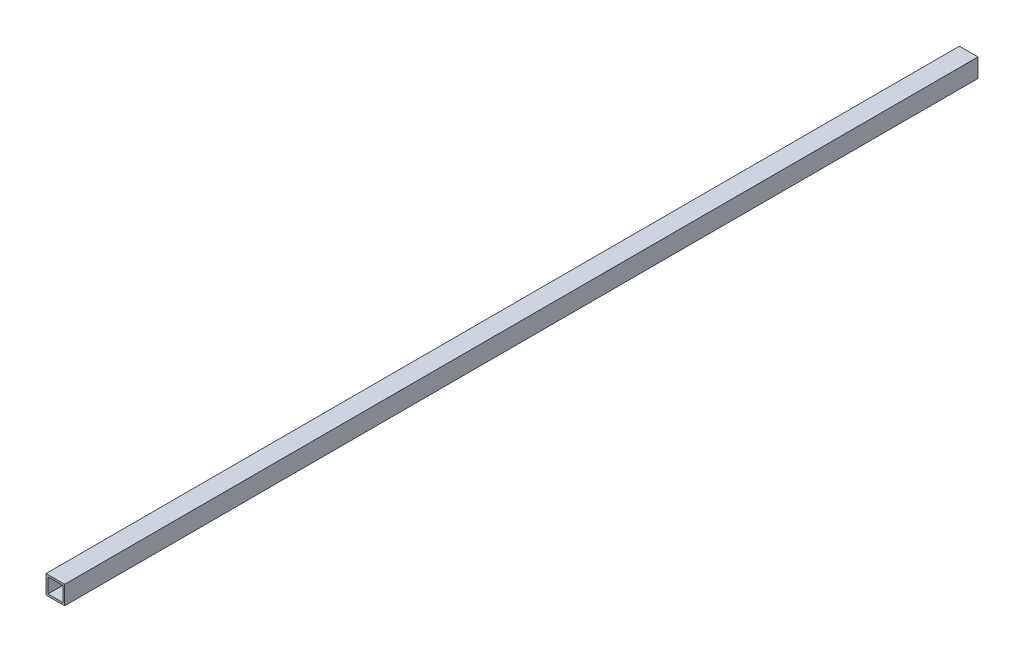
from build123d import *

# Parameters (mm, degrees)
SZKIC1_W                    = 10
SZKIC1_H                    = 10
SZKIC1_W_2                  = 8
SZKIC1_H_2                  = 8
DODANIE_WYCI_GNI_CIE1_DEPTH = 490


with BuildPart() as part:
    # Szkic1 → Dodanie-wyciągnięcie1 (new body)
    with BuildSketch(Plane.XY):
        Rectangle(SZKIC1_W, SZKIC1_H)
        Rectangle(SZKIC1_W_2, SZKIC1_H_2, mode=Mode.SUBTRACT)
    extrude(amount=DODANIE_WYCI_GNI_CIE1_DEPTH)


solid = part.part
